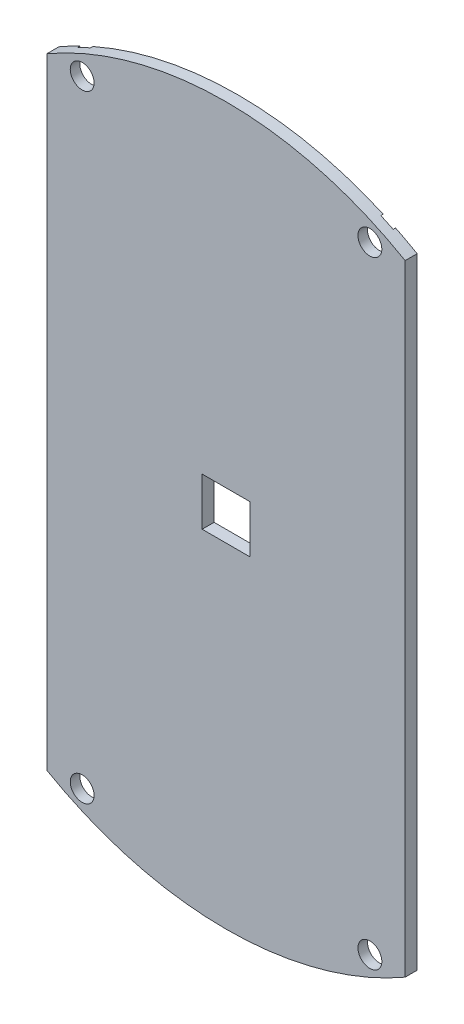
from build123d import *

# Parameters (mm, degrees)
SKETCH2_R            = 2.54
SKETCH2_W            = 10.16
SKETCH2_H            = 10.16
BOSS_EXTRUDE1_DEPTH  = 2.54
CUT_EXTRUDE1_DEPTH   = 0.508
CIRPATTERN1_COUNT    = 2
CIRPATTERN1_ANGLE    = 50
MIRROR2_COPY_1_DEPTH = 0.508


with BuildPart() as part:
    # Sketch2 → Boss-Extrude1 (new body)
    with BuildSketch(Plane.XY):
        with BuildLine():
            Line((-38.1, -65.991135768), (-38.1, 65.991135768))
            ThreePointArc((-38.1, 65.991135768), (0, 76.2), (38.1, 65.991135768))
            Line((38.1, 65.991135768), (38.1, -65.991135768))
            ThreePointArc((38.1, -65.991135768), (0, -76.2), (-38.1, -65.991135768))
        make_face()
        with Locations((30.593335967, 65.607620704)):
            Circle(SKETCH2_R, mode=Mode.SUBTRACT)
        with Locations((-30.593335967, -65.607620704)):
            Circle(SKETCH2_R, mode=Mode.SUBTRACT)
        with Locations((-30.593335967, 65.607620704)):
            Circle(SKETCH2_R, mode=Mode.SUBTRACT)
        with Locations((30.593335967, -65.607620704)):
            Circle(SKETCH2_R, mode=Mode.SUBTRACT)
        Rectangle(SKETCH2_W, SKETCH2_H, mode=Mode.SUBTRACT)
    extrude(amount=BOSS_EXTRUDE1_DEPTH)

    # Sketch6 → Cut-Extrude1 (cut)
    with BuildSketch(Plane.XY):
        with BuildLine():
            ThreePointArc((30.882724846, 69.661304223), (28.875815352, 61.924385857), (33.512622116, 68.434962986))
            ThreePointArc((33.512622116, 68.434962986), (32.203511545, 69.060653372), (30.882724846, 69.661304223))
        make_face()
    cut_extrude1 = extrude(amount=CUT_EXTRUDE1_DEPTH, mode=Mode.SUBTRACT)

    # CirPattern1: Cut-Extrude1 ×2 about axis
    cirpattern1_axis = Axis((0, 0, 2.54), (0, 0, 1))
    for i in range(1, CIRPATTERN1_COUNT):
        add(cut_extrude1.rotate(cirpattern1_axis, i * CIRPATTERN1_ANGLE / (CIRPATTERN1_COUNT - 1)), mode=Mode.SUBTRACT)

    # Mirror2: Cut-Extrude1 across plane
    add(cut_extrude1.mirror(Plane(origin=(0, 0, 0), x_dir=(0, 0, 1), z_dir=(0, -1, 0))), mode=Mode.SUBTRACT)

    # Mirror2 copy 1 sketch → Mirror2 copy 1 (cut)
    with BuildSketch(Plane(origin=(0, 0, 0), x_dir=(0.6427876096865379, -0.7660444431189793, 0), z_dir=(0, 0, 1))):
        with BuildLine():
            ThreePointArc((30.882724846, -69.661304223), (28.875815352, -61.924385857), (33.512622116, -68.434962986))
            ThreePointArc((33.512622116, -68.434962986), (32.203511545, -69.060653372), (30.882724846, -69.661304223))
        make_face()
    extrude(amount=MIRROR2_COPY_1_DEPTH, mode=Mode.SUBTRACT)


solid = part.part
